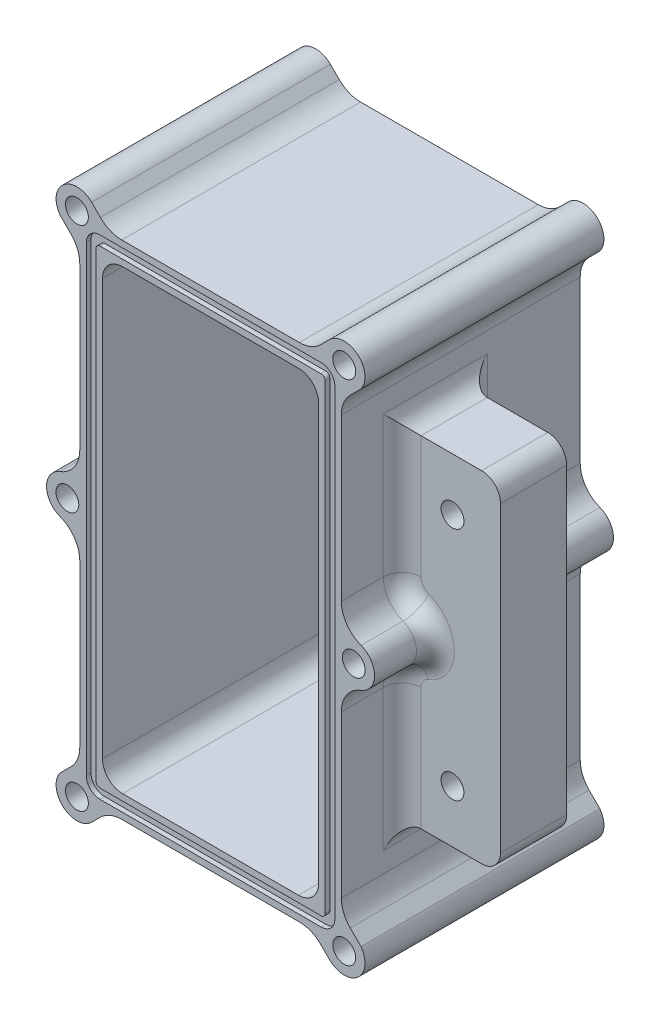
from build123d import *

# Parameters (mm, degrees)
SKETCH2_W                = 57.15
SKETCH2_H                = 120.65
BOSS_EXTRUDE1_DEPTH      = 28.575
SHELL1_T                 = 6
SKETCH3_W                = 57.15
SKETCH3_H                = 120.65
CUT_EXTRUDE1_DEPTH       = 50.8
FILLET1_R                = 5.334
CUT_EXTRUDE2_DEPTH       = 1.2446
BOSS_EXTRUDE2_START      = -63.15
BOSS_EXTRUDE2_DEPTH      = 63.15
SKETCH7_R                = 3.025
CUT_EXTRUDE3_DEPTH       = 10
MIRROR3_START            = -63.15
MIRROR3_COPY_1_DEPTH     = 63.15
MIRROR3_COPY_2_SKETCH_R  = 3.025
MIRROR3_COPY_2_DEPTH     = 10
BOSS_EXTRUDE3_DEPTH      = 63.15
SKETCH9_R                = 3.025
CUT_EXTRUDE4_DEPTH       = 10
CUT_EXTRUDE5_START       = -10
SKETCH10_R               = 3.025
CUT_EXTRUDE5_DEPTH       = 10
MIRROR10_START           = -10
MIRROR10_COPY_1_SKETCH_R = 3.025
MIRROR10_COPY_1_DEPTH    = 10
CUT_EXTRUDE6_START       = -10
SKETCH11_R               = 3.025
CUT_EXTRUDE6_DEPTH       = 10
FILLET2_R                = 8
SKETCH13_R               = 3.025
BOSS_EXTRUDE4_DEPTH      = 17.5
FILLET3_R                = 5


with BuildPart() as part:
    # Sketch2 → Boss-Extrude1 (new, symmetric)
    with BuildSketch(Plane.XY):
        Rectangle(SKETCH2_W, SKETCH2_H)
    extrude(amount=BOSS_EXTRUDE1_DEPTH, both=True)

    # Shell1
    shell1_openings = [part.faces().sort_by_distance(p)[0] for p in [
        (0, 0, 28.575),
    ]]
    offset(amount=SHELL1_T, openings=shell1_openings, kind=Kind.INTERSECTION)

    # Sketch3 → Cut-Extrude1 (cut)
    with BuildSketch(Plane.XY.offset(-28.575)):
        Rectangle(SKETCH3_W, SKETCH3_H)
    extrude(amount=-CUT_EXTRUDE1_DEPTH, mode=Mode.SUBTRACT)

    # Fillet1
    fillet1_edges = [part.edges().sort_by_distance(p)[0] for p in [
        (28.575, -60.325, -3),
        (28.575, 60.325, -3),
        (-28.575, 60.325, -3),
        (-28.575, -60.325, -3),
        (34.575, -66.325, -3),
        (-34.575, -66.325, -3),
        (-34.575, 66.325, -3),
        (34.575, 66.325, -3),
    ]]
    fillet(fillet1_edges, radius=FILLET1_R)

    # Sketch5 → Cut-Extrude2 (cut)
    with BuildSketch(Plane(origin=(0, 0, -34.575), x_dir=(-1, 0, 0), z_dir=(0, 0, -1))):
        with BuildLine():
            Line((-29.241, -64.6077), (29.241, -64.6077))
            ThreePointArc((29.241, -64.6077), (31.798393096, -63.548393096), (32.8577, -60.991))
            Line((32.8577, -60.991), (32.8577, 60.991))
            ThreePointArc((32.8577, 60.991), (31.798393096, 63.548393096), (29.241, 64.6077))
            Line((29.241, 64.6077), (-29.241, 64.6077))
            ThreePointArc((-29.241, 64.6077), (-31.798393096, 63.548393096), (-32.8577, 60.991))
            Line((-32.8577, 60.991), (-32.8577, -60.991))
            ThreePointArc((-32.8577, -60.991), (-31.798393096, -63.548393096), (-29.241, -64.6077))
        make_face()
        with BuildLine():
            Line((-30.2923, 60.991), (-30.2923, -60.991))
            ThreePointArc((-30.2923, -60.991), (-29.984381359, -61.734381359), (-29.241, -62.0423))
            Line((-29.241, -62.0423), (29.241, -62.0423))
            ThreePointArc((29.241, -62.0423), (29.984381359, -61.734381359), (30.2923, -60.991))
            Line((30.2923, -60.991), (30.2923, 60.991))
            ThreePointArc((30.2923, 60.991), (29.984381359, 61.734381359), (29.241, 62.0423))
            Line((29.241, 62.0423), (-29.241, 62.0423))
            ThreePointArc((-29.241, 62.0423), (-29.984381359, 61.734381359), (-30.2923, 60.991))
        make_face(mode=Mode.SUBTRACT)
    cut_extrude2 = extrude(amount=-CUT_EXTRUDE2_DEPTH, mode=Mode.SUBTRACT)

    # Sketch6 → Boss-Extrude2 (add)
    with BuildSketch(Plane(origin=(0, 0, -34.575), x_dir=(-1, 0, 0), z_dir=(0, 0, -1)).offset(BOSS_EXTRUDE2_START)):
        with BuildLine():
            ThreePointArc((29.241, 66.325), (31.282233428, 65.918973426), (33.012707571, 64.762707571))
            ThreePointArc((33.012707571, 64.762707571), (34.168973426, 63.032233428), (34.575, 60.991))
            Line((34.575, 60.991), (34.575, 58.636687414))
            Line((34.575, 58.636687414), (39.767542704, 63.829230118))
            ThreePointArc((39.767542704, 63.829230118), (38.916180607, 71.257349949), (31.444839705, 70.973014298))
            Line((31.444839705, 70.973014298), (26.796825407, 66.325))
            Line((26.796825407, 66.325), (29.241, 66.325))
        make_face()
    boss_extrude2 = extrude(amount=BOSS_EXTRUDE2_DEPTH)

    # Sketch7 → Cut-Extrude3 (cut)
    with BuildSketch(Plane(origin=(0, 0, -34.575), x_dir=(-1, 0, 0), z_dir=(0, 0, -1))):
        with Locations((35.333927001, 67.083927001)):
            Circle(SKETCH7_R)
    cut_extrude3 = extrude(amount=-CUT_EXTRUDE3_DEPTH, mode=Mode.SUBTRACT)

    # Mirror2: Boss-Extrude2, Cut-Extrude3 across plane
    add(boss_extrude2.mirror(Plane(origin=(0, 0, 0), x_dir=(0, 0, 1), z_dir=(1, 0, 0))))
    add(cut_extrude3.mirror(Plane(origin=(0, 0, 0), x_dir=(0, 0, 1), z_dir=(1, 0, 0))), mode=Mode.SUBTRACT)

    # Mirror3: Boss-Extrude2, Cut-Extrude3 across plane
    add(boss_extrude2.mirror(Plane.ZX))
    add(cut_extrude3.mirror(Plane.ZX), mode=Mode.SUBTRACT)

    # Mirror3 copy 1 sketch → Mirror3 copy 1 (add)
    with BuildSketch(Plane(origin=(0, 0, -34.575), x_dir=(1, 0, 0), z_dir=(0, 0, -1)).offset(MIRROR3_START)):
        with BuildLine():
            ThreePointArc((29.241, 66.325), (31.282233428, 65.918973426), (33.012707571, 64.762707571))
            ThreePointArc((33.012707571, 64.762707571), (34.168973426, 63.032233428), (34.575, 60.991))
            Line((34.575, 60.991), (34.575, 58.636687414))
            Line((34.575, 58.636687414), (39.767542704, 63.829230118))
            ThreePointArc((39.767542704, 63.829230118), (38.916180607, 71.257349949), (31.444839705, 70.973014298))
            Line((31.444839705, 70.973014298), (26.796825407, 66.325))
            Line((26.796825407, 66.325), (29.241, 66.325))
        make_face()
    extrude(amount=MIRROR3_COPY_1_DEPTH)

    # Mirror3 copy 2 sketch → Mirror3 copy 2 (cut)
    with BuildSketch(Plane(origin=(0, 0, -34.575), x_dir=(1, 0, 0), z_dir=(0, 0, -1))):
        with Locations((35.333927001, 67.083927001)):
            Circle(MIRROR3_COPY_2_SKETCH_R)
    extrude(amount=-MIRROR3_COPY_2_DEPTH, mode=Mode.SUBTRACT)

    # Sketch8 → Boss-Extrude3 (add)
    with BuildSketch(Plane(origin=(0, 0, -34.575), x_dir=(-1, 0, 0), z_dir=(0, 0, -1))):
        with BuildLine():
            Line((34.575, 0), (34.575, -5.5))
            Line((34.575, -5.5), (37.8577, -5.5))
            ThreePointArc((37.8577, -5.5), (43.3577, 0), (37.8577, 5.5))
            Line((37.8577, 5.5), (34.575, 5.5))
            Line((34.575, 5.5), (34.575, 0))
        make_face()
    boss_extrude3 = extrude(amount=-BOSS_EXTRUDE3_DEPTH)

    # Sketch9 → Cut-Extrude4 (cut)
    with BuildSketch(Plane(origin=(0, 0, -34.575), x_dir=(-1, 0, 0), z_dir=(0, 0, -1))):
        with Locations((37.8577, 0)):
            Circle(SKETCH9_R)
    cut_extrude4 = extrude(amount=-CUT_EXTRUDE4_DEPTH, mode=Mode.SUBTRACT)

    # Mirror4: Boss-Extrude3, Cut-Extrude4 across plane
    add(boss_extrude3.mirror(Plane(origin=(0, 0, 0), x_dir=(0, 0, 1), z_dir=(1, 0, 0))))
    add(cut_extrude4.mirror(Plane(origin=(0, 0, 0), x_dir=(0, 0, 1), z_dir=(1, 0, 0))), mode=Mode.SUBTRACT)

    # Mirror6: Cut-Extrude2 across plane
    add(cut_extrude2.mirror(Plane.XY.offset(-3)), mode=Mode.SUBTRACT)

    # Sketch10 → Cut-Extrude5 (cut)
    with BuildSketch(Plane.XY.offset(28.575).offset(CUT_EXTRUDE5_START)):
        with Locations(Location((-35.333927001, 67.083927001, 0), (0, 0, 180))):
            Circle(SKETCH10_R)
    cut_extrude5 = extrude(amount=CUT_EXTRUDE5_DEPTH, mode=Mode.SUBTRACT)

    # Mirror9: Cut-Extrude5 across plane
    add(cut_extrude5.mirror(Plane(origin=(0, 0, 0), x_dir=(0, 0, 1), z_dir=(1, 0, 0))), mode=Mode.SUBTRACT)

    # Mirror10: Cut-Extrude5 across plane
    add(cut_extrude5.mirror(Plane.ZX), mode=Mode.SUBTRACT)

    # Mirror10 copy 1 sketch → Mirror10 copy 1 (cut)
    with BuildSketch(Plane(origin=(0, 0, 28.575), x_dir=(-1, 0, 0), z_dir=(0, 0, 1)).offset(MIRROR10_START)):
        with Locations(Location((-35.333927001, 67.083927001, 0), (0, 0, 180))):
            Circle(MIRROR10_COPY_1_SKETCH_R)
    extrude(amount=MIRROR10_COPY_1_DEPTH, mode=Mode.SUBTRACT)

    # Sketch11 → Cut-Extrude6 (cut)
    with BuildSketch(Plane.XY.offset(28.575).offset(CUT_EXTRUDE6_START)):
        with Locations(Location((-37.8577, 0, 0), (0, 0, 180))):
            Circle(SKETCH11_R)
    cut_extrude6 = extrude(amount=CUT_EXTRUDE6_DEPTH, mode=Mode.SUBTRACT)

    # Mirror11: Cut-Extrude6 across plane
    add(cut_extrude6.mirror(Plane(origin=(0, 0, 0), x_dir=(0, 0, 1), z_dir=(1, 0, 0))), mode=Mode.SUBTRACT)

    # Fillet2
    fillet2_edges = [part.edges().sort_by_distance(p)[0] for p in [
        (-34.575, 5.5, -3),
        (-34.575, -5.5, -3),
        (-34.575, -58.636687414, -3),
        (-26.796825407, -66.325, -3),
        (26.796825407, -66.325, -3),
        (34.575, -58.636687414, -3),
        (34.575, -5.5, -3),
        (34.575, 5.5, -3),
        (34.575, 58.636687414, -3),
        (26.796825407, 66.325, -3),
        (-26.796825407, 66.325, -3),
        (-34.575, 58.636687414, -3),
    ]]
    fillet(fillet2_edges, radius=FILLET2_R)

    # Sketch13 → Boss-Extrude4 (add)
    with BuildSketch(Plane.XY.offset(-5)):
        with BuildLine():
            Line((34.575, -12.648995245), (34.575, -45))
            Line((34.575, -45), (60.575, -45))
            Line((60.575, -45), (60.575, 45))
            Line((60.575, 45), (34.575, 45))
            Line((34.575, 45), (34.575, 12.648995245))
            ThreePointArc((34.575, 12.648995245), (36.003717922, 8.086292992), (39.779562963, 5.153294359))
            ThreePointArc((39.779562963, 5.153294359), (43.3577, 0), (39.779562963, -5.153294359))
            ThreePointArc((39.779562963, -5.153294359), (36.003717922, -8.086292992), (34.575, -12.648995245))
        make_face()
        with Locations((47.875, -31.075)):
            Circle(SKETCH13_R, mode=Mode.SUBTRACT)
        with Locations((47.875, 31.075)):
            Circle(SKETCH13_R, mode=Mode.SUBTRACT)
    extrude(amount=BOSS_EXTRUDE4_DEPTH)

    # Fillet3
    fillet3_edges = [part.edges().sort_by_distance(p)[0] for p in [
        (43.3577, 0, 12.5),
        (36.003717922, -8.086292992, -5),
        (34.575, -28.824497623, 12.5),
        (34.575, -45, 3.75),
        (60.575, -45, 3.75),
        (60.575, 45, 3.75),
        (34.575, 28.824497623, 12.5),
        (34.575, 45, 3.75),
        (36.003717922, 8.086292992, -5),
        (36.003717922, -8.086292992, 12.5),
        (36.003717922, 8.086292992, 12.5),
        (43.3577, 0, -5),
        (34.575, 28.824497623, -5),
        (34.575, -28.824497623, -5),
    ]]
    fillet(fillet3_edges, radius=FILLET3_R)


solid = part.part
